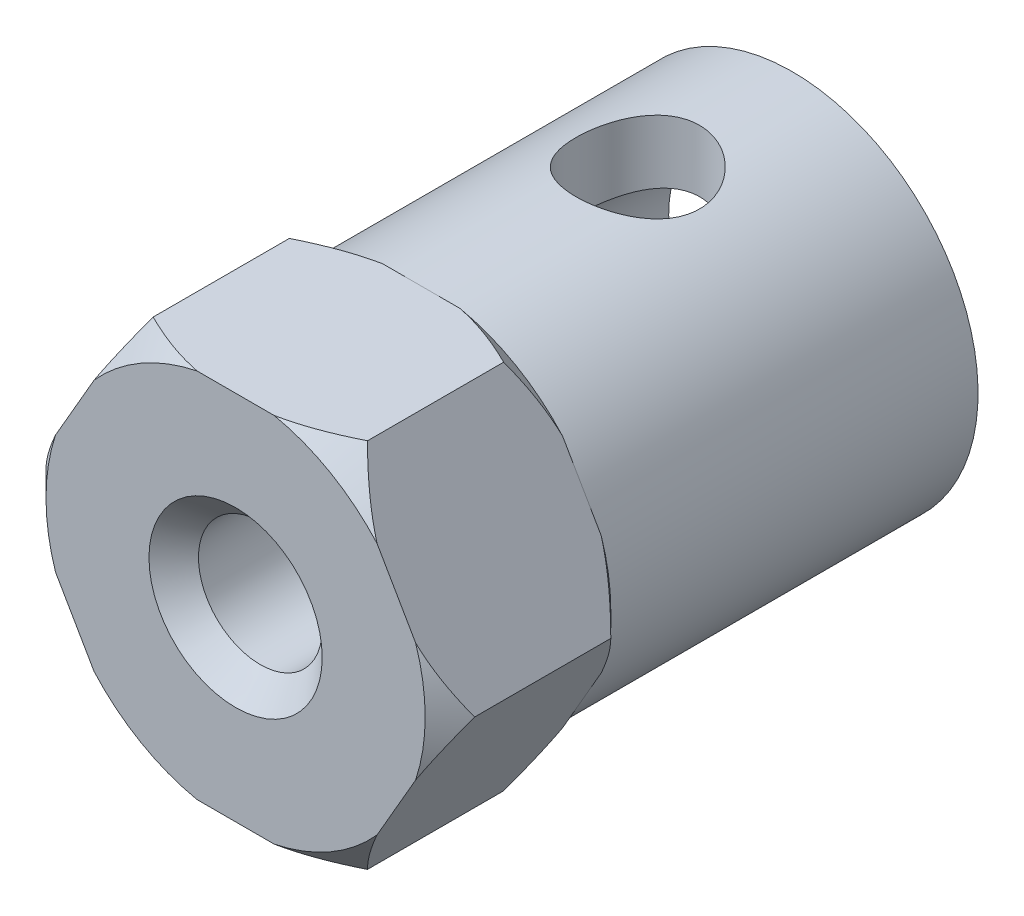
from build123d import *

# Parameters (mm, degrees)
EXTRUDE_1_DEPTH     = 6
SKETCH_2_R          = 6
SKETCH_2_R_2        = 4
EXTRUDE_2_DEPTH     = 12
SKETCH_3_R          = 2
CUT_EXTRUDE_1_DEPTH = 12
CHAMFER_1_SIZE      = 0.8
SKETCH_4_R          = 2
CUT_EXTRUDE_2_DEPTH = 6


with BuildPart() as part:
    # 草图1 → 凸台-拉伸1 (new body)
    with BuildSketch(Plane.XY):
        Polygon((6.92820323, 0), (3.464101615, 6), (-3.464101615, 6), (-6.92820323, 0), (-3.464101615, -6), (3.464101615, -6), align=None)
    extrude(amount=EXTRUDE_1_DEPTH)

    # 草图2 → 凸台-拉伸2 (add)
    with BuildSketch(Plane(origin=(0, 0, 0), x_dir=(-1, 0, 0), z_dir=(0, 0, -1))):
        with Locations(Location((0, 0, 0), (0, 0, 150))):
            Circle(SKETCH_2_R)
        Circle(SKETCH_2_R_2, mode=Mode.SUBTRACT)
    extrude(amount=EXTRUDE_2_DEPTH)

    # 草图3 → 切除-拉伸1 (cut)
    with BuildSketch(Plane.XY.offset(6)):
        Circle(SKETCH_3_R)
    extrude(amount=-CUT_EXTRUDE_1_DEPTH, mode=Mode.SUBTRACT)

    # 倒角1
    chamfer_1_edges = [part.edges().sort_by_distance(p)[0] for p in [
        (-2, 0, 6),
    ]]
    chamfer(chamfer_1_edges, length=CHAMFER_1_SIZE)

    # 草图4 → 切除-拉伸2 (cut, symmetric)
    with BuildSketch(Plane(origin=(0, 0, 0), x_dir=(1, 0, 0), z_dir=(0, 1, 0))):
        with Locations(Location((0, 7, 0), (0, 0, 270))):
            Circle(SKETCH_4_R)
    extrude(amount=CUT_EXTRUDE_2_DEPTH, both=True, mode=Mode.SUBTRACT)

    # 草图5 → 切除-旋转1 (revolve, cut)
    with BuildSketch(Plane(origin=(0, 0, 0), x_dir=(1, 0, 0), z_dir=(0, 1, 0))):
        Polygon((-6.92820323, 0), (-6.12820323, 0), (-6.92820323, -0.8), align=None)
        Polygon((-6.92820323, -5.2), (-6.92820323, -6), (-6.12820323, -6), align=None)
    revolve(axis=Axis((0, 0, 0), (0, 0, 1)), mode=Mode.SUBTRACT)


solid = part.part
